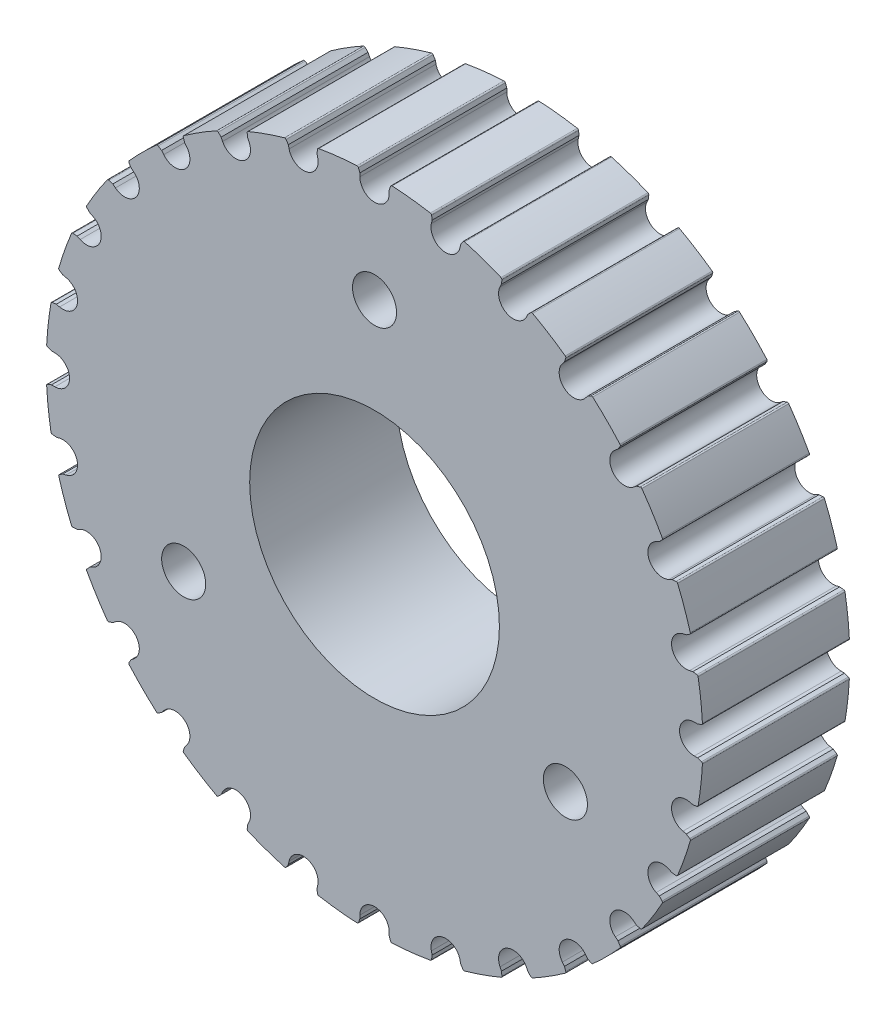
from build123d import *

# Parameters (mm, degrees)
SKETCH_1_R          = 8.5
EXTRUDE_1_DEPTH     = 10
FILLET_1_R          = 0.1
FILLET_2_R          = 0.1
CUT_EXTRUDE_1_DEPTH = 10
SKETCH_3_R          = 1.5
CUT_EXTRUDE_2_DEPTH = 10


with BuildPart() as part:
    # Эскиз1 → Вытянуть1 (new body)
    with BuildSketch(Plane.XY):
        with BuildLine():
            Line((-0.676, 21.1), (0, 21.1))
            Line((0, 21.1), (0.676, 21.1))
            Line((0.676, 21.1), (1.120729088, 22.321883126))
            ThreePointArc((1.120729088, 22.321883126), (2.502406041, 22.209467891), (3.874456211, 22.011612596))
            Line((3.874456211, 22.011612596), (4.036140438, 20.721403098))
            Line((4.036140438, 20.721403098), (4.695191706, 20.570978947))
            Line((4.695191706, 20.570978947), (5.354242975, 20.420554796))
            Line((5.354242975, 20.420554796), (6.059716351, 21.512841229))
            ThreePointArc((6.059716351, 21.512841229), (7.381737035, 21.095792432), (8.675360098, 20.597587897))
            Line((8.675360098, 20.597587897), (8.545891941, 19.30374852))
            Line((8.545891941, 19.30374852), (9.154946895, 19.010443113))
            Line((9.154946895, 19.010443113), (9.76400185, 18.717137705))
            Line((9.76400185, 18.717137705), (10.694844133, 19.625055643))
            ThreePointArc((10.694844133, 19.625055643), (11.89091691, 18.924285853), (13.041245203, 18.150714133))
            Line((13.041245203, 18.150714133), (12.627116737, 16.918123386))
            Line((12.627116737, 16.918123386), (13.155634819, 16.49664428))
            Line((13.155634819, 16.49664428), (13.684152901, 16.075165174))
            Line((13.684152901, 16.075165174), (14.793687772, 16.753187819))
            ThreePointArc((14.793687772, 16.753187819), (15.80383656, 15.80383656), (16.753187819, 14.793687772))
            Line((16.753187819, 14.793687772), (16.075165174, 13.684152901))
            Line((16.075165174, 13.684152901), (16.49664428, 13.155634819))
            Line((16.49664428, 13.155634819), (16.918123386, 12.627116737))
            Line((16.918123386, 12.627116737), (18.150714133, 13.041245203))
            ThreePointArc((18.150714133, 13.041245203), (18.924285853, 11.89091691), (19.625055643, 10.694844133))
            Line((19.625055643, 10.694844133), (18.717137705, 9.76400185))
            Line((18.717137705, 9.76400185), (19.010443113, 9.154946895))
            Line((19.010443113, 9.154946895), (19.30374852, 8.545891941))
            Line((19.30374852, 8.545891941), (20.597587897, 8.675360098))
            ThreePointArc((20.597587897, 8.675360098), (21.095792432, 7.381737035), (21.512841229, 6.059716351))
            Line((21.512841229, 6.059716351), (20.420554796, 5.354242975))
            Line((20.420554796, 5.354242975), (20.570978947, 4.695191706))
            Line((20.570978947, 4.695191706), (20.721403098, 4.036140438))
            Line((20.721403098, 4.036140438), (22.011612596, 3.874456211))
            ThreePointArc((22.011612596, 3.874456211), (22.209467891, 2.502406041), (22.321883126, 1.120729088))
            Line((22.321883126, 1.120729088), (21.1, 0.676))
            Line((21.1, 0.676), (21.1, 0))
            Line((21.1, 0), (21.1, -0.676))
            Line((21.1, -0.676), (22.321883126, -1.120729088))
            ThreePointArc((22.321883126, -1.120729088), (22.209467891, -2.502406041), (22.011612596, -3.874456211))
            Line((22.011612596, -3.874456211), (20.721403098, -4.036140438))
            Line((20.721403098, -4.036140438), (20.570978947, -4.695191706))
            Line((20.570978947, -4.695191706), (20.420554796, -5.354242975))
            Line((20.420554796, -5.354242975), (21.512841229, -6.059716351))
            ThreePointArc((21.512841229, -6.059716351), (21.095792432, -7.381737035), (20.597587897, -8.675360098))
            Line((20.597587897, -8.675360098), (19.30374852, -8.545891941))
            Line((19.30374852, -8.545891941), (19.010443113, -9.154946895))
            Line((19.010443113, -9.154946895), (18.717137705, -9.76400185))
            Line((18.717137705, -9.76400185), (19.625055643, -10.694844133))
            ThreePointArc((19.625055643, -10.694844133), (18.924285853, -11.89091691), (18.150714133, -13.041245203))
            Line((18.150714133, -13.041245203), (16.918123386, -12.627116737))
            Line((16.918123386, -12.627116737), (16.49664428, -13.155634819))
            Line((16.49664428, -13.155634819), (16.075165174, -13.684152901))
            Line((16.075165174, -13.684152901), (16.753187819, -14.793687772))
            ThreePointArc((16.753187819, -14.793687772), (15.80383656, -15.80383656), (14.793687772, -16.753187819))
            Line((14.793687772, -16.753187819), (13.684152901, -16.075165174))
            Line((13.684152901, -16.075165174), (13.155634819, -16.49664428))
            Line((13.155634819, -16.49664428), (12.627116737, -16.918123386))
            Line((12.627116737, -16.918123386), (13.041245203, -18.150714133))
            ThreePointArc((13.041245203, -18.150714133), (11.89091691, -18.924285853), (10.694844133, -19.625055643))
            Line((10.694844133, -19.625055643), (9.76400185, -18.717137705))
            Line((9.76400185, -18.717137705), (9.154946895, -19.010443113))
            Line((9.154946895, -19.010443113), (8.545891941, -19.30374852))
            Line((8.545891941, -19.30374852), (8.675360098, -20.597587897))
            ThreePointArc((8.675360098, -20.597587897), (7.381737035, -21.095792432), (6.059716351, -21.512841229))
            Line((6.059716351, -21.512841229), (5.354242975, -20.420554796))
            Line((5.354242975, -20.420554796), (4.695191706, -20.570978947))
            Line((4.695191706, -20.570978947), (4.036140438, -20.721403098))
            Line((4.036140438, -20.721403098), (3.874456211, -22.011612596))
            ThreePointArc((3.874456211, -22.011612596), (2.502406041, -22.209467891), (1.120729088, -22.321883126))
            Line((1.120729088, -22.321883126), (0.676, -21.1))
            Line((0.676, -21.1), (0, -21.1))
            Line((0, -21.1), (-0.676, -21.1))
            Line((-0.676, -21.1), (-1.120729088, -22.321883126))
            ThreePointArc((-1.120729088, -22.321883126), (-2.502406041, -22.209467891), (-3.874456211, -22.011612596))
            Line((-3.874456211, -22.011612596), (-4.036140438, -20.721403098))
            Line((-4.036140438, -20.721403098), (-4.695191706, -20.570978947))
            Line((-4.695191706, -20.570978947), (-5.354242975, -20.420554796))
            Line((-5.354242975, -20.420554796), (-6.059716351, -21.512841229))
            ThreePointArc((-6.059716351, -21.512841229), (-7.381737035, -21.095792432), (-8.675360098, -20.597587897))
            Line((-8.675360098, -20.597587897), (-8.545891941, -19.30374852))
            Line((-8.545891941, -19.30374852), (-9.154946895, -19.010443113))
            Line((-9.154946895, -19.010443113), (-9.76400185, -18.717137705))
            Line((-9.76400185, -18.717137705), (-10.694844133, -19.625055643))
            ThreePointArc((-10.694844133, -19.625055643), (-11.89091691, -18.924285853), (-13.041245203, -18.150714133))
            Line((-13.041245203, -18.150714133), (-12.627116737, -16.918123386))
            Line((-12.627116737, -16.918123386), (-13.155634819, -16.49664428))
            Line((-13.155634819, -16.49664428), (-13.684152901, -16.075165174))
            Line((-13.684152901, -16.075165174), (-14.793687772, -16.753187819))
            ThreePointArc((-14.793687772, -16.753187819), (-15.80383656, -15.80383656), (-16.753187819, -14.793687772))
            Line((-16.753187819, -14.793687772), (-16.075165174, -13.684152901))
            Line((-16.075165174, -13.684152901), (-16.49664428, -13.155634819))
            Line((-16.49664428, -13.155634819), (-16.918123386, -12.627116737))
            Line((-16.918123386, -12.627116737), (-18.150714133, -13.041245203))
            ThreePointArc((-18.150714133, -13.041245203), (-18.924285853, -11.89091691), (-19.625055643, -10.694844133))
            Line((-19.625055643, -10.694844133), (-18.717137705, -9.76400185))
            Line((-18.717137705, -9.76400185), (-19.010443113, -9.154946895))
            Line((-19.010443113, -9.154946895), (-19.30374852, -8.545891941))
            Line((-19.30374852, -8.545891941), (-20.597587897, -8.675360098))
            ThreePointArc((-20.597587897, -8.675360098), (-21.095792432, -7.381737035), (-21.512841229, -6.059716351))
            Line((-21.512841229, -6.059716351), (-20.420554796, -5.354242975))
            Line((-20.420554796, -5.354242975), (-20.570978947, -4.695191706))
            Line((-20.570978947, -4.695191706), (-20.721403098, -4.036140438))
            Line((-20.721403098, -4.036140438), (-22.011612596, -3.874456211))
            ThreePointArc((-22.011612596, -3.874456211), (-22.209467891, -2.502406041), (-22.321883126, -1.120729088))
            Line((-22.321883126, -1.120729088), (-21.1, -0.676))
            Line((-21.1, -0.676), (-21.1, 0))
            Line((-21.1, 0), (-21.1, 0.676))
            Line((-21.1, 0.676), (-22.321883126, 1.120729088))
            ThreePointArc((-22.321883126, 1.120729088), (-22.209467891, 2.502406041), (-22.011612596, 3.874456211))
            Line((-22.011612596, 3.874456211), (-20.721403098, 4.036140438))
            Line((-20.721403098, 4.036140438), (-20.570978947, 4.695191706))
            Line((-20.570978947, 4.695191706), (-20.420554796, 5.354242975))
            Line((-20.420554796, 5.354242975), (-21.512841229, 6.059716351))
            ThreePointArc((-21.512841229, 6.059716351), (-21.095792432, 7.381737035), (-20.597587897, 8.675360098))
            Line((-20.597587897, 8.675360098), (-19.30374852, 8.545891941))
            Line((-19.30374852, 8.545891941), (-19.010443113, 9.154946895))
            Line((-19.010443113, 9.154946895), (-18.717137705, 9.76400185))
            Line((-18.717137705, 9.76400185), (-19.625055643, 10.694844133))
            ThreePointArc((-19.625055643, 10.694844133), (-18.924285853, 11.89091691), (-18.150714133, 13.041245203))
            Line((-18.150714133, 13.041245203), (-16.918123386, 12.627116737))
            Line((-16.918123386, 12.627116737), (-16.49664428, 13.155634819))
            Line((-16.49664428, 13.155634819), (-16.075165174, 13.684152901))
            Line((-16.075165174, 13.684152901), (-16.753187819, 14.793687772))
            ThreePointArc((-16.753187819, 14.793687772), (-15.80383656, 15.80383656), (-14.793687772, 16.753187819))
            Line((-14.793687772, 16.753187819), (-13.684152901, 16.075165174))
            Line((-13.684152901, 16.075165174), (-13.155634819, 16.49664428))
            Line((-13.155634819, 16.49664428), (-12.627116737, 16.918123386))
            Line((-12.627116737, 16.918123386), (-13.041245203, 18.150714133))
            ThreePointArc((-13.041245203, 18.150714133), (-11.89091691, 18.924285853), (-10.694844133, 19.625055643))
            Line((-10.694844133, 19.625055643), (-9.76400185, 18.717137705))
            Line((-9.76400185, 18.717137705), (-9.154946895, 19.010443113))
            Line((-9.154946895, 19.010443113), (-8.545891941, 19.30374852))
            Line((-8.545891941, 19.30374852), (-8.675360098, 20.597587897))
            ThreePointArc((-8.675360098, 20.597587897), (-7.381737035, 21.095792432), (-6.059716351, 21.512841229))
            Line((-6.059716351, 21.512841229), (-5.354242975, 20.420554796))
            Line((-5.354242975, 20.420554796), (-4.695191706, 20.570978947))
            Line((-4.695191706, 20.570978947), (-4.036140438, 20.721403098))
            Line((-4.036140438, 20.721403098), (-3.874456211, 22.011612596))
            ThreePointArc((-3.874456211, 22.011612596), (-2.502406041, 22.209467891), (-1.120729088, 22.321883126))
            Line((-1.120729088, 22.321883126), (-0.676, 21.1))
        make_face()
        Circle(SKETCH_1_R, mode=Mode.SUBTRACT)
    extrude(amount=EXTRUDE_1_DEPTH)

    # Скругление1
    fillet_1_edges = [part.edges().sort_by_distance(p)[0] for p in [
        (4.036140438, 20.721403098, 5),
        (5.354242975, 20.420554796, 5),
        (6.059716351, 21.512841229, 5),
        (8.675360098, 20.597587897, 5),
        (8.545891941, 19.30374852, 5),
        (9.76400185, 18.717137705, 5),
        (10.694844133, 19.625055643, 5),
        (13.041245203, 18.150714133, 5),
        (12.627116737, 16.918123386, 5),
        (13.684152901, 16.075165174, 5),
        (14.793687772, 16.753187819, 5),
        (16.918123386, 12.627116737, 5),
        (18.150714133, 13.041245203, 5),
        (19.30374852, 8.545891941, 5),
        (20.597587897, 8.675360098, 5),
        (20.721403098, 4.036140438, 5),
        (22.011612596, 3.874456211, 5),
        (21.1, -0.676, 5),
        (22.321883126, -1.120729088, 5),
        (20.420554796, -5.354242975, 5),
        (21.512841229, -6.059716351, 5),
        (18.717137705, -9.76400185, 5),
        (19.625055643, -10.694844133, 5),
        (16.075165174, -13.684152901, 5),
        (16.753187819, -14.793687772, 5),
        (12.627116737, -16.918123386, 5),
        (13.041245203, -18.150714133, 5),
        (8.545891941, -19.30374852, 5),
        (8.675360098, -20.597587897, 5),
        (4.036140438, -20.721403098, 5),
        (3.874456211, -22.011612596, 5),
        (-0.676, -21.1, 5),
        (-1.120729088, -22.321883126, 5),
        (-5.354242975, -20.420554796, 5),
        (-6.059716351, -21.512841229, 5),
        (-9.76400185, -18.717137705, 5),
        (-10.694844133, -19.625055643, 5),
        (-13.684152901, -16.075165174, 5),
        (-14.793687772, -16.753187819, 5),
        (-16.753187819, -14.793687772, 5),
        (-16.075165174, -13.684152901, 5),
        (-16.918123386, -12.627116737, 5),
        (-18.150714133, -13.041245203, 5),
        (-19.625055643, -10.694844133, 5),
        (-18.717137705, -9.76400185, 5),
        (-19.30374852, -8.545891941, 5),
        (-20.597587897, -8.675360098, 5),
        (-21.512841229, -6.059716351, 5),
        (-20.420554796, -5.354242975, 5),
        (-20.721403098, -4.036140438, 5),
        (-22.011612596, -3.874456211, 5),
        (-22.321883126, -1.120729088, 5),
        (-21.1, -0.676, 5),
        (-21.1, 0.676, 5),
        (-22.321883126, 1.120729088, 5),
        (-22.011612596, 3.874456211, 5),
        (-20.721403098, 4.036140438, 5),
        (-20.420554796, 5.354242975, 5),
        (-21.512841229, 6.059716351, 5),
        (-20.597587897, 8.675360098, 5),
        (-19.30374852, 8.545891941, 5),
        (-18.717137705, 9.76400185, 5),
        (-19.625055643, 10.694844133, 5),
        (-18.150714133, 13.041245203, 5),
        (-16.918123386, 12.627116737, 5),
        (-16.075165174, 13.684152901, 5),
        (-16.753187819, 14.793687772, 5),
        (-14.793687772, 16.753187819, 5),
        (-12.627116737, 16.918123386, 5),
        (-13.041245203, 18.150714133, 5),
        (-10.694844133, 19.625055643, 5),
        (-9.76400185, 18.717137705, 5),
        (-8.545891941, 19.30374852, 5),
        (-8.675360098, 20.597587897, 5),
        (-6.059716351, 21.512841229, 5),
        (-5.354242975, 20.420554796, 5),
        (-4.036140438, 20.721403098, 5),
        (-3.874456211, 22.011612596, 5),
        (-1.120729088, 22.321883126, 5),
        (-0.676, 21.1, 5),
        (0.676, 21.1, 5),
        (1.120729088, 22.321883126, 5),
        (3.874456211, 22.011612596, 5),
    ]]
    fillet(fillet_1_edges, radius=FILLET_1_R)

    # Скругление2
    fillet_2_edges = [part.edges().sort_by_distance(p)[0] for p in [
        (16.753187819, 14.793687772, 5),
        (16.075165174, 13.684152901, 5),
        (19.625055643, 10.694844133, 5),
        (18.717137705, 9.76400185, 5),
        (21.512841229, 6.059716351, 5),
        (20.420554796, 5.354242975, 5),
        (22.321883126, 1.120729088, 5),
        (21.1, 0.676, 5),
        (22.011612596, -3.874456211, 5),
        (20.721403098, -4.036140438, 5),
        (20.597587897, -8.675360098, 5),
        (19.30374852, -8.545891941, 5),
        (18.150714133, -13.041245203, 5),
        (16.918123386, -12.627116737, 5),
        (14.793687772, -16.753187819, 5),
        (13.684152901, -16.075165174, 5),
        (10.694844133, -19.625055643, 5),
        (9.76400185, -18.717137705, 5),
        (6.059716351, -21.512841229, 5),
        (5.354242975, -20.420554796, 5),
        (1.120729088, -22.321883126, 5),
        (0.676, -21.1, 5),
        (-3.874456211, -22.011612596, 5),
        (-4.036140438, -20.721403098, 5),
        (-8.675360098, -20.597587897, 5),
        (-8.545891941, -19.30374852, 5),
        (-13.041245203, -18.150714133, 5),
        (-12.627116737, -16.918123386, 5),
    ]]
    fillet(fillet_2_edges, radius=FILLET_2_R)

    # Эскиз2 → Вырез-Вытянуть1 (cut)
    with BuildSketch(Plane.XY.offset(10)):
        with BuildLine():
            Line((6.081506374, 22.150861154), (5.81701011, 20.992027307))
            ThreePointArc((5.81701011, 20.992027307), (4.619561264, 20.239620329), (3.867154286, 21.437069175))
            Line((3.867154286, 21.437069175), (4.131650549, 22.595903021))
            Line((4.131650549, 22.595903021), (6.081506374, 22.150861154))
        make_face()
        with BuildLine():
            Line((-1, 22.948755296), (1, 22.948755296))
            Line((1, 22.948755296), (1, 21.760119878))
            ThreePointArc((1, 21.760119878), (0, 20.760119878), (-1, 21.760119878))
            Line((-1, 21.760119878), (-1, 22.948755296))
        make_face()
        with BuildLine():
            Line((10.858060624, 20.242230339), (10.342331044, 19.171306833))
            ThreePointArc((10.342331044, 19.171306833), (9.007478437, 18.704221704), (8.540393308, 20.039074311))
            Line((8.540393308, 20.039074311), (9.056122888, 21.109997818))
            Line((9.056122888, 21.109997818), (10.858060624, 20.242230339))
        make_face()
        with BuildLine():
            Line((15.090146375, 17.318569572), (14.349044313, 16.389256981))
            ThreePointArc((14.349044313, 16.389256981), (12.943723029, 16.2309153), (12.785381349, 17.636236585))
            Line((12.785381349, 17.636236585), (13.52648341, 18.565549175))
            Line((13.52648341, 18.565549175), (15.090146375, 17.318569572))
        make_face()
        with BuildLine():
            Line((18.565549175, 13.52648341), (17.636236585, 12.785381349))
            ThreePointArc((17.636236585, 12.785381349), (16.2309153, 12.943723029), (16.389256981, 14.349044313))
            Line((16.389256981, 14.349044313), (17.318569572, 15.090146375))
            Line((17.318569572, 15.090146375), (18.565549175, 13.52648341))
        make_face()
        with BuildLine():
            Line((21.109997818, 9.056122888), (20.039074311, 8.540393308))
            ThreePointArc((20.039074311, 8.540393308), (18.704221704, 9.007478437), (19.171306833, 10.342331044))
            Line((19.171306833, 10.342331044), (20.242230339, 10.858060624))
            Line((20.242230339, 10.858060624), (21.109997818, 9.056122888))
        make_face()
        with BuildLine():
            Line((22.595903021, 4.131650549), (21.437069175, 3.867154286))
            ThreePointArc((21.437069175, 3.867154286), (20.239620329, 4.619561264), (20.992027307, 5.81701011))
            Line((20.992027307, 5.81701011), (22.150861154, 6.081506374))
            Line((22.150861154, 6.081506374), (22.595903021, 4.131650549))
        make_face()
        with BuildLine():
            Line((22.948755296, -1), (21.760119878, -1))
            ThreePointArc((21.760119878, -1), (20.760119878, 0), (21.760119878, 1))
            Line((21.760119878, 1), (22.948755296, 1))
            Line((22.948755296, 1), (22.948755296, -1))
        make_face()
        with BuildLine():
            Line((22.150861154, -6.081506374), (20.992027307, -5.81701011))
            ThreePointArc((20.992027307, -5.81701011), (20.239620329, -4.619561264), (21.437069175, -3.867154286))
            Line((21.437069175, -3.867154286), (22.595903021, -4.131650549))
            Line((22.595903021, -4.131650549), (22.150861154, -6.081506374))
        make_face()
        with BuildLine():
            Line((20.242230339, -10.858060624), (19.171306833, -10.342331044))
            ThreePointArc((19.171306833, -10.342331044), (18.704221704, -9.007478437), (20.039074311, -8.540393308))
            Line((20.039074311, -8.540393308), (21.109997818, -9.056122888))
            Line((21.109997818, -9.056122888), (20.242230339, -10.858060624))
        make_face()
        with BuildLine():
            Line((17.318569572, -15.090146375), (16.389256981, -14.349044313))
            ThreePointArc((16.389256981, -14.349044313), (16.2309153, -12.943723029), (17.636236585, -12.785381349))
            Line((17.636236585, -12.785381349), (18.565549175, -13.52648341))
            Line((18.565549175, -13.52648341), (17.318569572, -15.090146375))
        make_face()
        with BuildLine():
            Line((13.52648341, -18.565549175), (12.785381349, -17.636236585))
            ThreePointArc((12.785381349, -17.636236585), (12.943723029, -16.2309153), (14.349044313, -16.389256981))
            Line((14.349044313, -16.389256981), (15.090146375, -17.318569572))
            Line((15.090146375, -17.318569572), (13.52648341, -18.565549175))
        make_face()
        with BuildLine():
            Line((9.056122888, -21.109997818), (8.540393308, -20.039074311))
            ThreePointArc((8.540393308, -20.039074311), (9.007478437, -18.704221704), (10.342331044, -19.171306833))
            Line((10.342331044, -19.171306833), (10.858060624, -20.242230339))
            Line((10.858060624, -20.242230339), (9.056122888, -21.109997818))
        make_face()
        with BuildLine():
            Line((4.131650549, -22.595903021), (3.867154286, -21.437069175))
            ThreePointArc((3.867154286, -21.437069175), (4.619561264, -20.239620329), (5.81701011, -20.992027307))
            Line((5.81701011, -20.992027307), (6.081506374, -22.150861154))
            Line((6.081506374, -22.150861154), (4.131650549, -22.595903021))
        make_face()
        with BuildLine():
            Line((-1, -22.948755296), (-1, -21.760119878))
            ThreePointArc((-1, -21.760119878), (0, -20.760119878), (1, -21.760119878))
            Line((1, -21.760119878), (1, -22.948755296))
            Line((1, -22.948755296), (-1, -22.948755296))
        make_face()
        with BuildLine():
            Line((-6.081506374, -22.150861154), (-5.81701011, -20.992027307))
            ThreePointArc((-5.81701011, -20.992027307), (-4.619561264, -20.239620329), (-3.867154286, -21.437069175))
            Line((-3.867154286, -21.437069175), (-4.131650549, -22.595903021))
            Line((-4.131650549, -22.595903021), (-6.081506374, -22.150861154))
        make_face()
        with BuildLine():
            Line((-10.858060624, -20.242230339), (-10.342331044, -19.171306833))
            ThreePointArc((-10.342331044, -19.171306833), (-9.007478437, -18.704221704), (-8.540393308, -20.039074311))
            Line((-8.540393308, -20.039074311), (-9.056122888, -21.109997818))
            Line((-9.056122888, -21.109997818), (-10.858060624, -20.242230339))
        make_face()
        with BuildLine():
            Line((-15.090146375, -17.318569572), (-14.349044313, -16.389256981))
            ThreePointArc((-14.349044313, -16.389256981), (-12.943723029, -16.2309153), (-12.785381349, -17.636236585))
            Line((-12.785381349, -17.636236585), (-13.52648341, -18.565549175))
            Line((-13.52648341, -18.565549175), (-15.090146375, -17.318569572))
        make_face()
        with BuildLine():
            Line((-18.565549175, -13.52648341), (-17.636236585, -12.785381349))
            ThreePointArc((-17.636236585, -12.785381349), (-16.2309153, -12.943723029), (-16.389256981, -14.349044313))
            Line((-16.389256981, -14.349044313), (-17.318569572, -15.090146375))
            Line((-17.318569572, -15.090146375), (-18.565549175, -13.52648341))
        make_face()
        with BuildLine():
            Line((-21.109997818, -9.056122888), (-20.039074311, -8.540393308))
            ThreePointArc((-20.039074311, -8.540393308), (-18.704221704, -9.007478437), (-19.171306833, -10.342331044))
            Line((-19.171306833, -10.342331044), (-20.242230339, -10.858060624))
            Line((-20.242230339, -10.858060624), (-21.109997818, -9.056122888))
        make_face()
        with BuildLine():
            Line((-22.595903021, -4.131650549), (-21.437069175, -3.867154286))
            ThreePointArc((-21.437069175, -3.867154286), (-20.239620329, -4.619561264), (-20.992027307, -5.81701011))
            Line((-20.992027307, -5.81701011), (-22.150861154, -6.081506374))
            Line((-22.150861154, -6.081506374), (-22.595903021, -4.131650549))
        make_face()
        with BuildLine():
            Line((-22.948755296, 1), (-21.760119878, 1))
            ThreePointArc((-21.760119878, 1), (-20.760119878, 0), (-21.760119878, -1))
            Line((-21.760119878, -1), (-22.948755296, -1))
            Line((-22.948755296, -1), (-22.948755296, 1))
        make_face()
        with BuildLine():
            Line((-22.150861154, 6.081506374), (-20.992027307, 5.81701011))
            ThreePointArc((-20.992027307, 5.81701011), (-20.239620329, 4.619561264), (-21.437069175, 3.867154286))
            Line((-21.437069175, 3.867154286), (-22.595903021, 4.131650549))
            Line((-22.595903021, 4.131650549), (-22.150861154, 6.081506374))
        make_face()
        with BuildLine():
            Line((-20.242230339, 10.858060624), (-19.171306833, 10.342331044))
            ThreePointArc((-19.171306833, 10.342331044), (-18.704221704, 9.007478437), (-20.039074311, 8.540393308))
            Line((-20.039074311, 8.540393308), (-21.109997818, 9.056122888))
            Line((-21.109997818, 9.056122888), (-20.242230339, 10.858060624))
        make_face()
        with BuildLine():
            Line((-17.318569572, 15.090146375), (-16.389256981, 14.349044313))
            ThreePointArc((-16.389256981, 14.349044313), (-16.2309153, 12.943723029), (-17.636236585, 12.785381349))
            Line((-17.636236585, 12.785381349), (-18.565549175, 13.52648341))
            Line((-18.565549175, 13.52648341), (-17.318569572, 15.090146375))
        make_face()
        with BuildLine():
            Line((-13.52648341, 18.565549175), (-12.785381349, 17.636236585))
            ThreePointArc((-12.785381349, 17.636236585), (-12.943723029, 16.2309153), (-14.349044313, 16.389256981))
            Line((-14.349044313, 16.389256981), (-15.090146375, 17.318569572))
            Line((-15.090146375, 17.318569572), (-13.52648341, 18.565549175))
        make_face()
        with BuildLine():
            Line((-9.056122888, 21.109997818), (-8.540393308, 20.039074311))
            ThreePointArc((-8.540393308, 20.039074311), (-9.007478437, 18.704221704), (-10.342331044, 19.171306833))
            Line((-10.342331044, 19.171306833), (-10.858060624, 20.242230339))
            Line((-10.858060624, 20.242230339), (-9.056122888, 21.109997818))
        make_face()
        with BuildLine():
            Line((-4.131650549, 22.595903021), (-3.867154286, 21.437069175))
            ThreePointArc((-3.867154286, 21.437069175), (-4.619561264, 20.239620329), (-5.81701011, 20.992027307))
            Line((-5.81701011, 20.992027307), (-6.081506374, 22.150861154))
            Line((-6.081506374, 22.150861154), (-4.131650549, 22.595903021))
        make_face()
    extrude(amount=-CUT_EXTRUDE_1_DEPTH, mode=Mode.SUBTRACT)

    # Эскиз3 → Вырез-Вытянуть2 (cut)
    with BuildSketch(Plane.XY.offset(10)):
        with Locations((0, 15)):
            Circle(SKETCH_3_R)
        with Locations((12.990381057, -7.5)):
            Circle(SKETCH_3_R)
        with Locations((-12.990381057, -7.5)):
            Circle(SKETCH_3_R)
    extrude(amount=-CUT_EXTRUDE_2_DEPTH, mode=Mode.SUBTRACT)


solid = part.part
